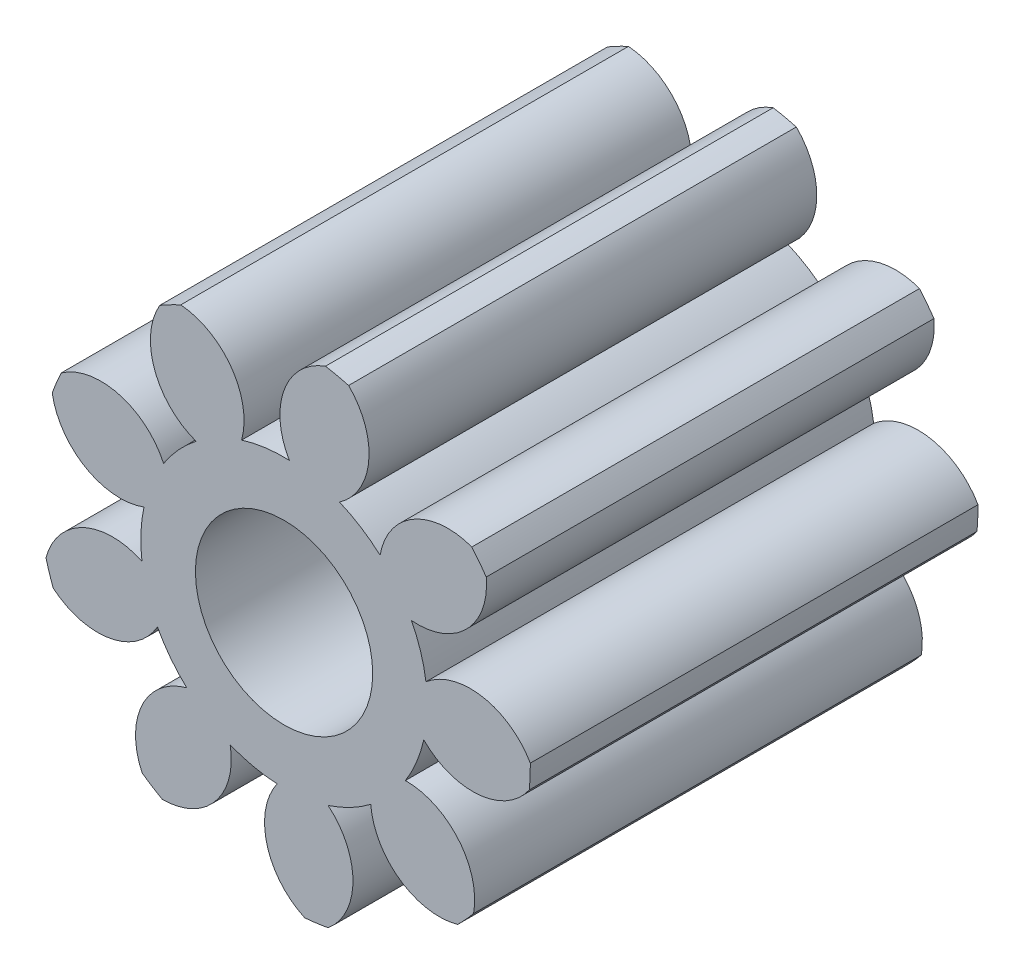
from build123d import *

# Parameters (mm, degrees)
CROQUIS1_R              = 2.75
CROQUIS1_R_2            = 0.99
SALIENTE_EXTRUIR1_DEPTH = 5
CORTAR_EXTRUIR1_START   = -5
CORTAR_EXTRUIR1_DEPTH   = 5
MATRIZC2_COUNT          = 9


with BuildPart() as part:
    # Croquis1 → Saliente-Extruir1 (new body)
    with BuildSketch(Plane.XY):
        Circle(CROQUIS1_R)
        Circle(CROQUIS1_R_2, mode=Mode.SUBTRACT)
    extrude(amount=SALIENTE_EXTRUIR1_DEPTH)

    # Croquis2 → Cortar-Extruir1 (cut)
    with BuildSketch(Plane.XY.offset(5).offset(CORTAR_EXTRUIR1_START)):
        with BuildLine():
            ThreePointArc((0.462433778, 2.710840276), (-0.361905182, 2.726082288), (-1.153713733, 2.496286166))
            ThreePointArc((-1.153713733, 2.496286166), (-0.586792069, 2.171686202), (-0.473646193, 1.528286388))
            ThreePointArc((-0.473646193, 1.528286388), (-0.210563015, 1.58608424), (0.058487762, 1.598930637))
            ThreePointArc((0.058487762, 1.598930637), (-0.000157922, 2.249565706), (0.462433778, 2.710840276))
        make_face()
    cortar_extruir1 = extrude(amount=CORTAR_EXTRUIR1_DEPTH, mode=Mode.SUBTRACT)

    # MatrizC2: Cortar-Extruir1 ×9 about axis
    matrizc2_axis = Axis((0, 0, 0), (0, 0, 1))
    for i in range(1, MATRIZC2_COUNT):
        add(cortar_extruir1.rotate(matrizc2_axis, i * 360 / MATRIZC2_COUNT), mode=Mode.SUBTRACT)


solid = part.part
